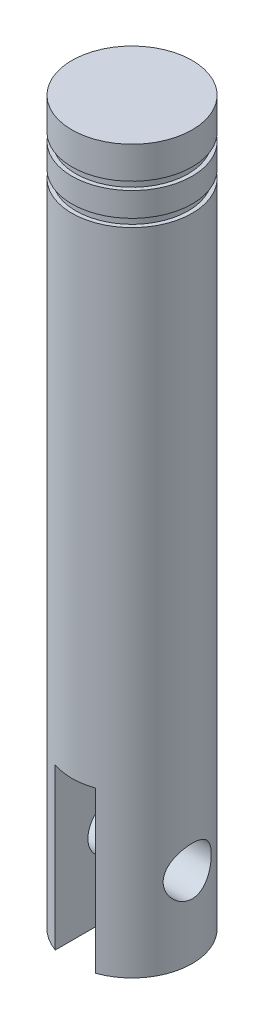
from build123d import *

# Parameters (mm, degrees)
SKIZZE2_W                            = 5
SKIZZE2_H                            = 20
SCHNITT_LINEAR_AUSTRAGEN1_DEPTH      = 49.023431781
SCHNITT_LINEAR_AUSTRAGEN2_DEPTH      = 47.233105022
SCHNITT_LINEAR_AUSTRAGEN2_DEPTH_BACK = 47.233105022
SKIZZE5_R                            = 3


with BuildPart() as part:
    # Skizze1 → Rotation2 (revolve)
    with BuildSketch(Plane.XY, mode=Mode.PRIVATE) as rotation2_sk:
        Polygon((0, -45), (0, 45), (-7.5, 45), (-7.5, 41), (-7, 41), (-7, 40), (-7.5, 40), (-7.5, 37), (-7, 37), (-7, 36), (-7.5, 36), (-7.5, -45), align=None)
    revolve(rotation2_sk.sketch.rotate(Axis((0, -45, 0), (0, 1, 0)), 180), axis=Axis((0, -45, 0), (0, 1, 0)))

    # Skizze2 → Schnitt-Linear austragen1 (cut, through all)
    with BuildSketch(Plane.XY.offset(7.5)):
        with Locations((0, -35)):
            Rectangle(SKIZZE2_W, SKIZZE2_H)
    extrude(amount=-SCHNITT_LINEAR_AUSTRAGEN1_DEPTH, mode=Mode.SUBTRACT)

    # Skizze5 → Schnitt-Linear austragen2 (cut, two sides: drawn at the far end of the back side and taken through both)
    with BuildSketch(Plane(origin=(0, 0, 0), x_dir=(0, 0, -1), z_dir=(1, 0, 0)).offset(-SCHNITT_LINEAR_AUSTRAGEN2_DEPTH_BACK)):
        with Locations(Location((0, -35, 0), (0, 0, 90))):
            Circle(SKIZZE5_R)
    extrude(amount=SCHNITT_LINEAR_AUSTRAGEN2_DEPTH + SCHNITT_LINEAR_AUSTRAGEN2_DEPTH_BACK, mode=Mode.SUBTRACT)


solid = part.part
